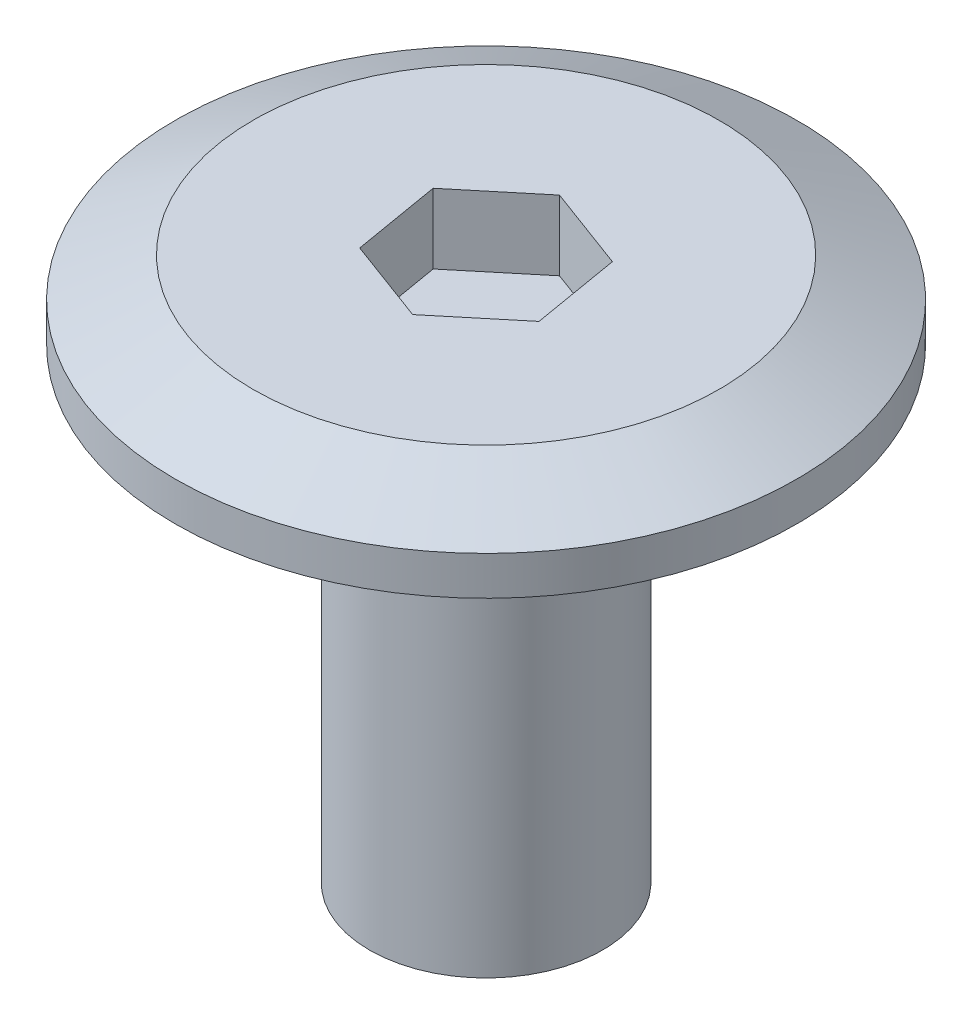
from build123d import *

# Parameters (mm, degrees)
SKETCH1_R           = 4
BOSS_EXTRUDE1_DEPTH = 1
CHAMFER1_SIZE       = 0.5
CHAMFER1_SIZE2      = 1
CUT_EXTRUDE1_DEPTH  = 0.9
SKETCH3_R           = 1.5
BOSS_EXTRUDE2_DEPTH = 6


with BuildPart() as part:
    # Sketch1 → Boss-Extrude1 (new body)
    with BuildSketch(Plane(origin=(0, 0, 0), x_dir=(1, 0, 0), z_dir=(0, 1, 0))):
        with Locations(Location((0, 0, 0), (0, 0, 270))):
            Circle(SKETCH1_R)
    extrude(amount=BOSS_EXTRUDE1_DEPTH)

    # Chamfer1
    chamfer1_edges = [part.edges().sort_by_distance(p)[0] for p in [
        (0, 1, -4),
    ]]
    chamfer1_side = [part.faces().sort_by_distance(p)[0] for p in [
        (0, 0.5, -4),
    ]]
    chamfer(chamfer1_edges, length=CHAMFER1_SIZE, length2=CHAMFER1_SIZE2, reference=chamfer1_side[0])

    # Sketch2 → Cut-Extrude1 (cut)
    with BuildSketch(Plane(origin=(0, 1, 0), x_dir=(1, 0, 0), z_dir=(0, 1, 0))):
        Polygon((0.88903539, 0.736851009), (-0.193613998, 1.138352737), (-1.082649387, 0.401501728), (-0.88903539, -0.736851009), (0.193613998, -1.138352737), (1.082649387, -0.401501728), align=None)
    extrude(amount=-CUT_EXTRUDE1_DEPTH, mode=Mode.SUBTRACT)

    # Sketch3 → Boss-Extrude2 (add)
    with BuildSketch(Plane.XZ):
        with Locations(Location((0, 0, 0), (0, 0, 90))):
            Circle(SKETCH3_R)
    extrude(amount=BOSS_EXTRUDE2_DEPTH)


solid = part.part
